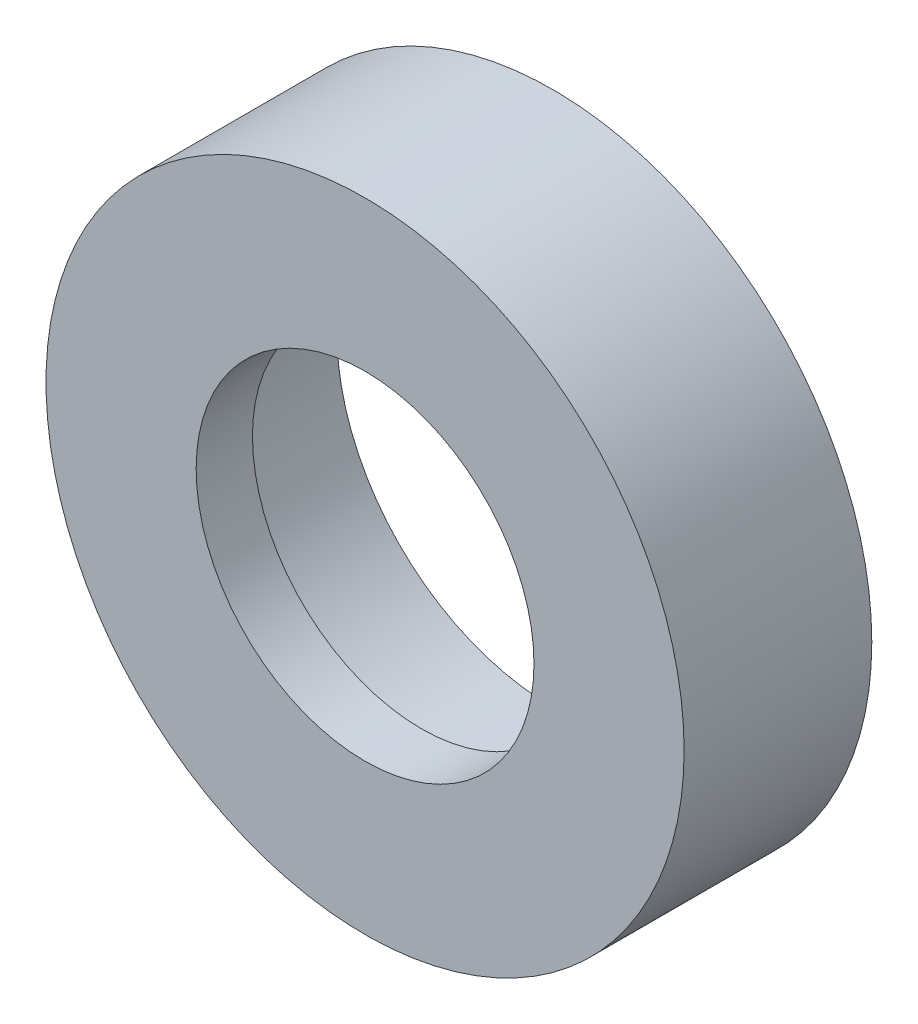
from build123d import *

# Parameters (mm, degrees)
SKETCH_1_R      = 17
SKETCH_1_R_2    = 11.5
EXTRUDE_1_DEPTH = 10
EXTRUDE_START   = -3
SKETCH_2_R      = 11.5
SKETCH_2_R_2    = 9
EXTRUDE_2_DEPTH = 3


with BuildPart() as part:
    # Эскиз1 → Бобышка-Вытянуть1 (new body)
    with BuildSketch(Plane.XY):
        Circle(SKETCH_1_R)
        Circle(SKETCH_1_R_2, mode=Mode.SUBTRACT)
    extrude(amount=EXTRUDE_1_DEPTH)

    # Эскиз2 → Бобышка-Вытянуть2 (add)
    with BuildSketch(Plane.XY.offset(10).offset(EXTRUDE_START)):
        Circle(SKETCH_2_R)
        Circle(SKETCH_2_R_2, mode=Mode.SUBTRACT)
    extrude(amount=EXTRUDE_2_DEPTH)


solid = part.part
